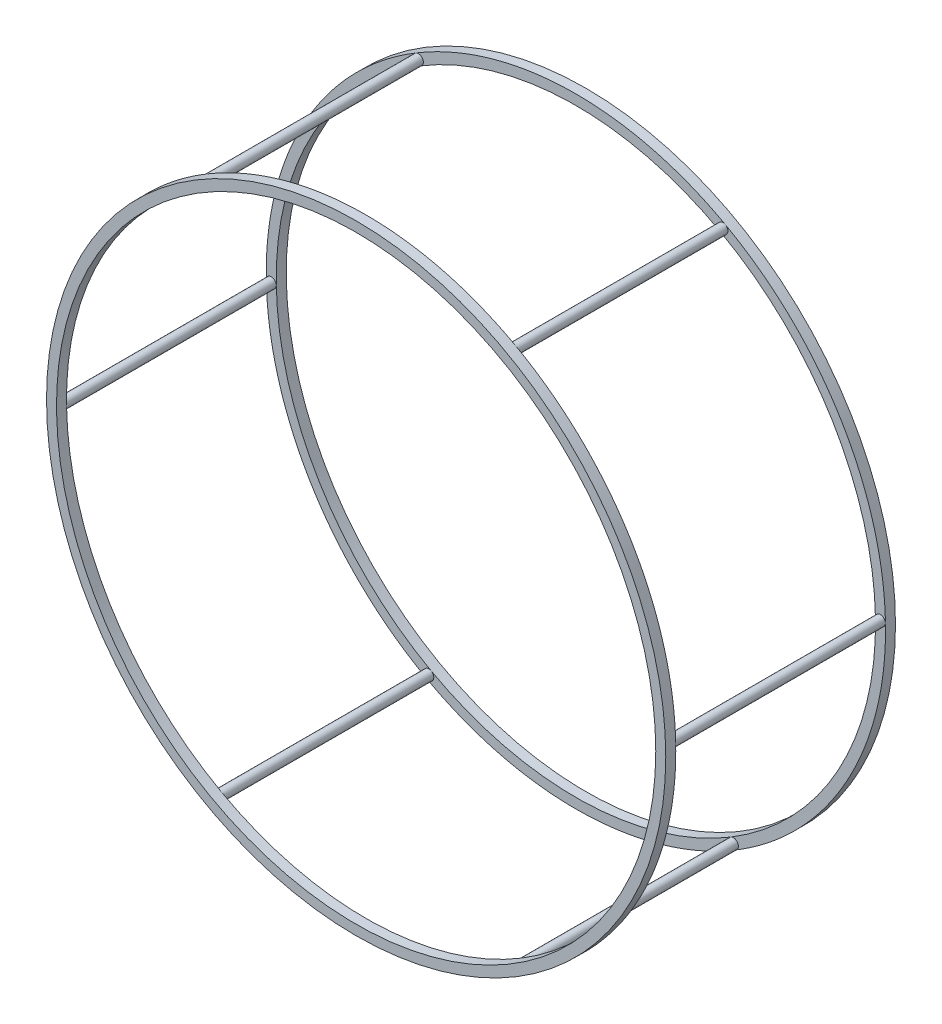
from build123d import *

# Parameters (mm, degrees)
SKETCH1_R               = 155
SKETCH1_R_2             = 150
BOSS_EXTRUDE1_DEPTH     = 115
CUT_EXTRUDE1_DEPTH      = 248.53787589
CUT_EXTRUDE1_DEPTH_BACK = 248.53787589
SKETCH2_W               = 105
SKETCH2_H               = 310
SKETCH3_R               = 2.499991986
BOSS_EXTRUDE2_DEPTH     = 105
CIRPATTERN2_COUNT       = 6


with BuildPart() as part:
    # Sketch1 → Boss-Extrude1 (new body)
    with BuildSketch(Plane.XY):
        Circle(SKETCH1_R)
        Circle(SKETCH1_R_2, mode=Mode.SUBTRACT)
    extrude(amount=BOSS_EXTRUDE1_DEPTH)

    # Sketch2 → Cut-Extrude1 (cut, two sides: drawn at the far end of the back side and taken through both)
    with BuildSketch(Plane(origin=(0, 0, 0), x_dir=(0, 0, -1), z_dir=(1, 0, 0)).offset(-CUT_EXTRUDE1_DEPTH_BACK)):
        with Locations((-57.5, 0)):
            Rectangle(SKETCH2_W, SKETCH2_H)
    extrude(amount=CUT_EXTRUDE1_DEPTH + CUT_EXTRUDE1_DEPTH_BACK, mode=Mode.SUBTRACT)


with BuildPart() as cut_extrude1_piece_1:
    # of the separate pieces the step leaves, piece 1, a body of its own (cut_extrude1_pieces)
    add(part.part.solids().sort_by_distance((155, 0, 110))[0])



with BuildPart() as cut_extrude1_piece_2:
    # of the separate pieces the step leaves, piece 2, a body of its own (cut_extrude1_pieces)
    add(part.part.solids().sort_by_distance((155, 0, 0))[0])


with BuildPart() as cut_extrude1_piece_1_1:
    add(cut_extrude1_piece_1.part)

    add(cut_extrude1_piece_2.part)  # Boss-Extrude2 merges Cut-Extrude1 piece 2
    # Sketch3 → Boss-Extrude2 (add)
    with BuildSketch(Plane(origin=(0, 0, 110), x_dir=(-1, 0, 0), z_dir=(0, 0, -1))):
        with Locations(Location((78.846059419, 130.535613799, 0), (0, 0, 238.867204155))):
            Circle(SKETCH3_R)
    boss_extrude2 = extrude(amount=BOSS_EXTRUDE2_DEPTH)

    # CirPattern2: Boss-Extrude2 ×6 about axis
    cirpattern2_axis = Axis((0, 0, 0), (0, 0, 1))
    for i in range(1, CIRPATTERN2_COUNT):
        add(boss_extrude2.rotate(cirpattern2_axis, i * 360 / CIRPATTERN2_COUNT))


solid = cut_extrude1_piece_1_1.part
